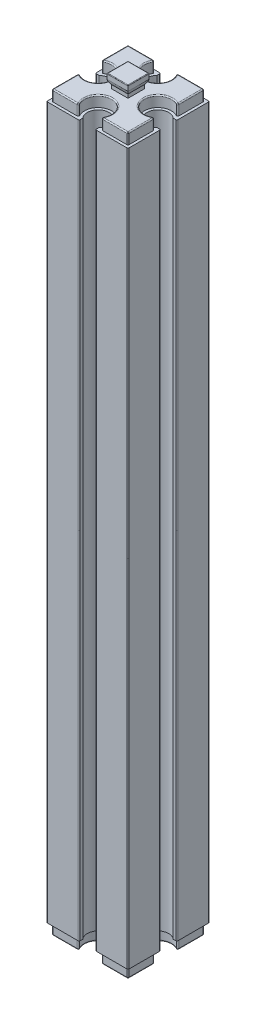
from build123d import *

# Parameters (mm, degrees)
EXTRUDE_1_DEPTH        = 65.5
EXTRUDE_2_DEPTH        = 2
EXTRUDE_3_DEPTH        = 2
FILLET_3_R             = 0.2
CUT_EXTRUDE_1_DEPTH    = 3
FILLET_4_R             = 0.2
FILLET_5_R             = 0.1
FILLET_3_OF_MIRROR_1_R = 0.2
FILLET_4_OF_MIRROR_1_R = 0.2
FILLET_5_OF_MIRROR_1_R = 0.1


with BuildPart() as part:
    # 草图1 → 凸台-拉伸1 (new body)
    with BuildSketch(Plane(origin=(0, 0, 0), x_dir=(1, 0, 0), z_dir=(0, 1, 0))):
        with BuildLine():
            Line((-7.5, 7.5), (-1.5, 7.5))
            Line((-1.5, 7.5), (-1.5, 6.822875656))
            ThreePointArc((-1.5, 6.822875656), (0, 3.5), (1.5, 6.822875656))
            Line((1.5, 6.822875656), (1.5, 7.5))
            Line((1.5, 7.5), (7.5, 7.5))
            Line((7.5, 7.5), (7.5, 1.5))
            Line((7.5, 1.5), (6.822875656, 1.5))
            ThreePointArc((6.822875656, 1.5), (3.5, 0), (6.822875656, -1.5))
            Line((6.822875656, -1.5), (7.5, -1.5))
            Line((7.5, -1.5), (7.5, -7.5))
            Line((7.5, -7.5), (1.5, -7.5))
            Line((1.5, -7.5), (1.5, -6.822875656))
            ThreePointArc((1.5, -6.822875656), (0, -3.5), (-1.5, -6.822875656))
            Line((-1.5, -6.822875656), (-1.5, -7.5))
            Line((-1.5, -7.5), (-7.5, -7.5))
            Line((-7.5, -7.5), (-7.5, -1.5))
            Line((-7.5, -1.5), (-6.822875656, -1.5))
            ThreePointArc((-6.822875656, -1.5), (-3.5, 0), (-6.822875656, 1.5))
            Line((-6.822875656, 1.5), (-7.5, 1.5))
            Line((-7.5, 1.5), (-7.5, 7.5))
        make_face()
    extrude_1 = extrude(amount=EXTRUDE_1_DEPTH)

    # 草图2 → 凸台-拉伸2 (add)
    with BuildSketch(Plane(origin=(0, 65.5, 0), x_dir=(1, 0, 0), z_dir=(0, 1, 0))):
        with BuildLine():
            Line((-7, 7), (-7, 2))
            ThreePointArc((-7, 2), (-3, 0), (-7, -2))
            Line((-7, -2), (-7, -7))
            Line((-7, -7), (-2, -7))
            ThreePointArc((-2, -7), (0, -3), (2, -7))
            Line((2, -7), (7, -7))
            Line((7, -7), (7, -2))
            ThreePointArc((7, -2), (3, 0), (7, 2))
            Line((7, 2), (7, 7))
            Line((7, 7), (2, 7))
            ThreePointArc((2, 7), (0, 3), (-2, 7))
            Line((-2, 7), (-7, 7))
        make_face()
    extrude_2 = extrude(amount=EXTRUDE_2_DEPTH)

    # 草图3 → 凸台-拉伸3 (add, symmetric)
    with BuildSketch(Plane(origin=(0, 0, 0), x_dir=(0, 0, -1), z_dir=(1, 0, 0))):
        with BuildLine():
            Line((-1.5, 67.5), (1.5, 67.5))
            Line((1.5, 67.5), (1.5, 68.177124344))
            ThreePointArc((1.5, 68.177124344), (1.780042303, 68.588161527), (1.95, 69.055590279))
            Line((1.95, 69.055590279), (1.95, 70))
            Line((1.95, 70), (-1.95, 70))
            Line((-1.95, 70), (-1.95, 69.055590279))
            ThreePointArc((-1.95, 69.055590279), (-1.780042303, 68.588161527), (-1.5, 68.177124344))
            Line((-1.5, 68.177124344), (-1.5, 67.5))
        make_face()
    extrude_3 = extrude(amount=EXTRUDE_3_DEPTH, both=True)

    # 圆角3
    fillet_3_edges = [part.edges().sort_by_distance(p)[0] for p in [
        (-7.5, 32.75, -7.5),
        (-1.5, 32.75, -7.5),
        (1.5, 32.75, -7.5),
        (7.5, 32.75, -7.5),
        (7.5, 32.75, -1.5),
        (7.5, 32.75, 1.5),
        (7.5, 32.75, 7.5),
        (1.5, 32.75, 7.5),
        (-1.5, 32.75, 7.5),
        (-7.5, 32.75, 7.5),
        (-7.5, 32.75, 1.5),
        (-6.822875656, 32.75, -1.5),
        (-7.5, 32.75, -1.5),
    ]]
    fillet(fillet_3_edges, radius=FILLET_3_R)

    # 草图4 → 切除-拉伸1 (cut, symmetric)
    with BuildSketch(Plane.XY):
        with BuildLine():
            Line((1.95, 70), (2, 70))
            Line((2, 70), (2, 67.5))
            Line((2, 67.5), (1.5, 67.5))
            Line((1.5, 67.5), (1.5, 68.177124344))
            ThreePointArc((1.5, 68.177124344), (1.780042303, 68.588161527), (1.95, 69.055590279))
            Line((1.95, 69.055590279), (1.95, 70))
        make_face()
        with BuildLine():
            Line((-1.95, 70), (-1.95, 69.055590279))
            ThreePointArc((-1.95, 69.055590279), (-1.780042303, 68.588161527), (-1.5, 68.177124344))
            Line((-1.5, 68.177124344), (-1.5, 67.5))
            Line((-1.5, 67.5), (-2, 67.5))
            Line((-2, 67.5), (-2, 70))
            Line((-2, 70), (-1.95, 70))
        make_face()
    cut_extrude_1 = extrude(amount=CUT_EXTRUDE_1_DEPTH, both=True, mode=Mode.SUBTRACT)

    # 圆角4
    fillet_4_edges = [part.edges().sort_by_distance(p)[0] for p in [
        (-2, 66.5, -7),
        (-7, 66.5, -7),
        (-7, 66.5, -2),
        (-7, 66.5, 2),
        (-7, 66.5, 7),
        (-2, 66.5, 7),
        (2, 66.5, 7),
        (7, 66.5, 7),
        (7, 66.5, 2),
        (7, 66.5, -2),
        (7, 66.5, -7),
        (2, 66.5, -7),
        (-4.5, 67.5, -7),
        (-7, 67.5, -4.5),
        (-3, 67.5, 0),
        (-7, 67.5, 4.5),
        (-4.5, 67.5, 7),
        (0, 67.5, 3),
        (4.5, 67.5, 7),
        (7, 67.5, 4.5),
        (3, 67.5, 0),
        (7, 67.5, -4.5),
        (4.5, 67.5, -7),
        (0, 67.5, -3),
    ]]
    fillet(fillet_4_edges, radius=FILLET_4_R)

    # 圆角5
    fillet_5_edges = [part.edges().sort_by_distance(p)[0] for p in [
        (1.95, 70, 0),
        (0, 70, -1.95),
        (0, 70, 1.95),
        (-1.95, 70, 0),
    ]]
    fillet(fillet_5_edges, radius=FILLET_5_R)


with BuildPart() as mirror_1_1:
    # 镜向1: 凸台-拉伸1, 凸台-拉伸2, 凸台-拉伸3 across Top Plane
    add(extrude_1.mirror(Plane(origin=(0, 0, 0), x_dir=(1, 0, 0), z_dir=(0, 1, 0))))
    add(extrude_2.mirror(Plane(origin=(0, 0, 0), x_dir=(1, 0, 0), z_dir=(0, 1, 0))))
    add(extrude_3.mirror(Plane(origin=(0, 0, 0), x_dir=(1, 0, 0), z_dir=(0, 1, 0))))

    # Mirror 1 2: 切除-拉伸1 across Top Plane
    add(cut_extrude_1.mirror(Plane(origin=(0, 0, 0), x_dir=(1, 0, 0), z_dir=(0, 1, 0))), mode=Mode.SUBTRACT)

    # 圆角3 of 镜向1
    fillet_3_of_mirror_1_edges = [mirror_1_1.edges().sort_by_distance(p)[0] for p in [
        (-7.5, -32.75, -7.5),
        (-1.5, -32.75, -7.5),
        (1.5, -32.75, -7.5),
        (7.5, -32.75, -7.5),
        (7.5, -32.75, -1.5),
        (7.5, -32.75, 1.5),
        (7.5, -32.75, 7.5),
        (1.5, -32.75, 7.5),
        (-1.5, -32.75, 7.5),
        (-7.5, -32.75, 7.5),
        (-7.5, -32.75, 1.5),
        (-6.822875656, -32.75, -1.5),
        (-7.5, -32.75, -1.5),
    ]]
    fillet(fillet_3_of_mirror_1_edges, radius=FILLET_3_OF_MIRROR_1_R)

    # 圆角4 of 镜向1
    fillet_4_of_mirror_1_edges = [mirror_1_1.edges().sort_by_distance(p)[0] for p in [
        (-2, -66.5, -7),
        (-7, -66.5, -7),
        (-7, -66.5, -2),
        (-7, -66.5, 2),
        (-7, -66.5, 7),
        (-2, -66.5, 7),
        (2, -66.5, 7),
        (7, -66.5, 7),
        (7, -66.5, 2),
        (7, -66.5, -2),
        (7, -66.5, -7),
        (2, -66.5, -7),
        (-4.5, -67.5, -7),
        (-7, -67.5, -4.5),
        (-3, -67.5, 0),
        (-7, -67.5, 4.5),
        (-4.5, -67.5, 7),
        (0, -67.5, 3),
        (4.5, -67.5, 7),
        (7, -67.5, 4.5),
        (3, -67.5, 0),
        (7, -67.5, -4.5),
        (4.5, -67.5, -7),
        (0, -67.5, -3),
    ]]
    fillet(fillet_4_of_mirror_1_edges, radius=FILLET_4_OF_MIRROR_1_R)

    # 圆角5 of 镜向1
    fillet_5_of_mirror_1_edges = [mirror_1_1.edges().sort_by_distance(p)[0] for p in [
        (1.95, -70, 0),
        (0, -70, -1.95),
        (0, -70, 1.95),
        (-1.95, -70, 0),
    ]]
    fillet(fillet_5_of_mirror_1_edges, radius=FILLET_5_OF_MIRROR_1_R)


with BuildPart() as part_1:
    add(part.part)

    # 镜向1 united with what the copies tou: union 镜向1_1
    add(mirror_1_1.part)


solid = part_1.part
